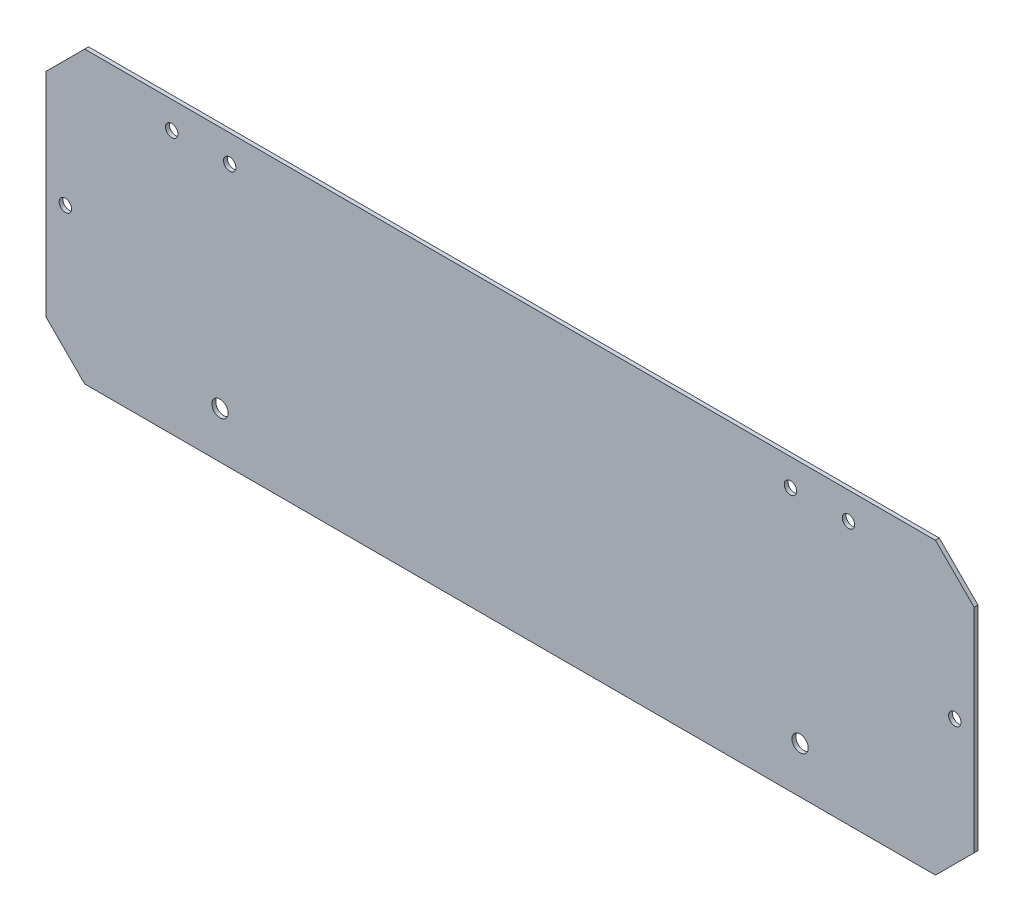
from build123d import *

# Parameters (mm, degrees)
SKETCH_1_W          = 240
SKETCH_1_H          = 75
EXTRUDE_1_DEPTH     = 1
CHAMFER_1_SIZE      = 10
SKETCH_4_R          = 2.1
SKETCH_4_R_2        = 1.6
CUT_EXTRUDE_3_DEPTH = 10


with BuildPart() as part:
    # 草图1 → 凸台-拉伸1 (new body)
    with BuildSketch(Plane.XY):
        with Locations((120, 37.5)):
            Rectangle(SKETCH_1_W, SKETCH_1_H)
    extrude(amount=EXTRUDE_1_DEPTH)

    # 倒角1
    chamfer_1_edges = [part.edges().sort_by_distance(p)[0] for p in [
        (0, 75, 0.5),
        (240, 75, 0.5),
        (240, 0, 0.5),
        (0, 0, 0.5),
    ]]
    chamfer(chamfer_1_edges, length=CHAMFER_1_SIZE)

    # 草图4 → 切除-拉伸3 (cut)
    with BuildSketch(Plane(origin=(0, 0, 0), x_dir=(-1, 0, 0), z_dir=(0, 0, -1))):
        with Locations((-195, 12)):
            Circle(SKETCH_4_R)
        with Locations((-45, 12)):
            Circle(SKETCH_4_R)
        with Locations((-207.5, 68)):
            Circle(SKETCH_4_R_2)
        with Locations((-192.5, 68)):
            Circle(SKETCH_4_R_2)
        with Locations((-47.5, 68)):
            Circle(SKETCH_4_R_2)
        with Locations((-32.5, 68)):
            Circle(SKETCH_4_R_2)
        with Locations((-235, 37.5)):
            Circle(SKETCH_4_R_2)
        with Locations((-5, 37.5)):
            Circle(SKETCH_4_R_2)
    extrude(amount=-CUT_EXTRUDE_3_DEPTH, mode=Mode.SUBTRACT)


solid = part.part
